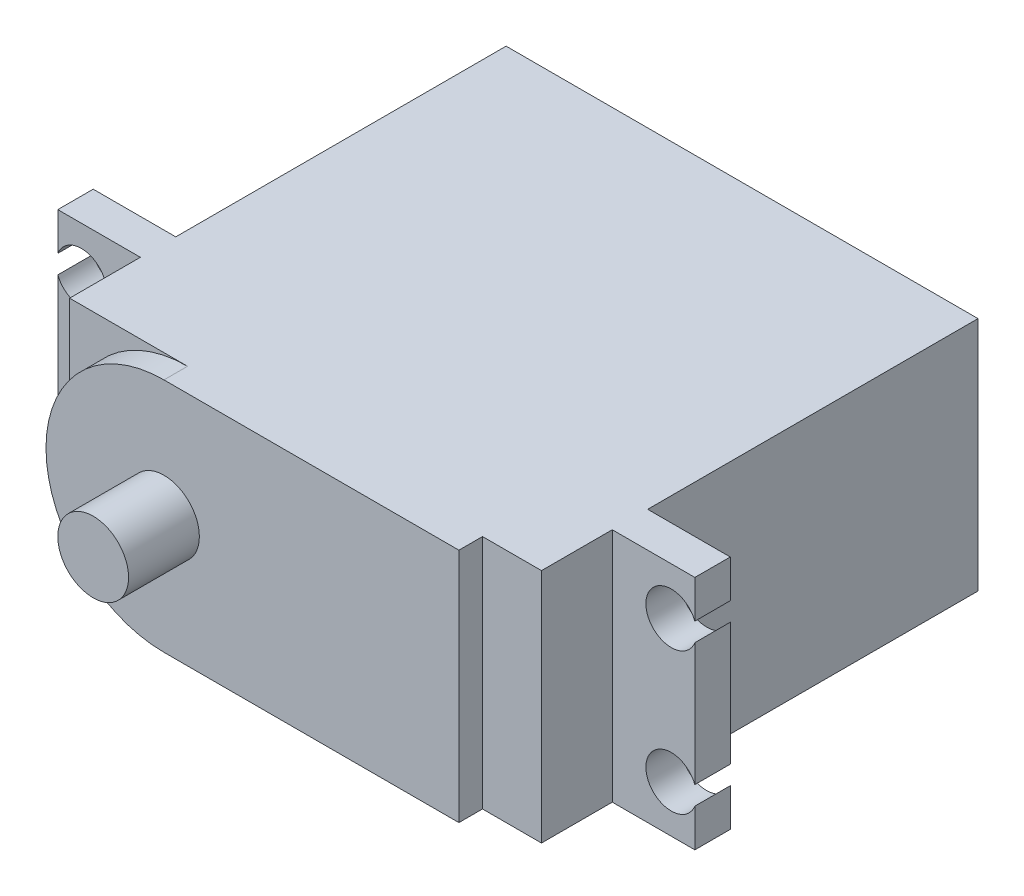
from build123d import *

# Parameters (mm, degrees)
SKETCH1_W           = 40
SKETCH1_H           = 20
BOSS_EXTRUDE1_DEPTH = 37
BOSS_EXTRUDE2_DEPTH = 2
SKETCH3_W           = 3
SKETCH3_H           = 20
BOSS_EXTRUDE3_DEPTH = 7
SKETCH4_W           = 3
SKETCH4_H           = 20
BOSS_EXTRUDE4_DEPTH = 7
SKETCH8_R           = 2.15
CUT_EXTRUDE9_DEPTH  = 7
CUT_EXTRUDE10_REACH = 44.308
SKETCH9_R           = 2.15
CUT_EXTRUDE11_REACH = 44.308
SKETCH10_R          = 2.15
SKETCH11_R          = 3
BOSS_EXTRUDE5_DEPTH = 6


with BuildPart() as part:
    # Sketch1 → Boss-Extrude1 (new body)
    with BuildSketch(Plane.XY):
        Rectangle(SKETCH1_W, SKETCH1_H)
    extrude(amount=BOSS_EXTRUDE1_DEPTH)

    # Sketch2 → Boss-Extrude2 (add)
    with BuildSketch(Plane.XY.offset(37)):
        with BuildLine():
            Line((15, 10), (15, -10))
            Line((15, -10), (-10, -10))
            ThreePointArc((-10, -10), (-20, 0), (-10, 10))
            Line((-10, 10), (15, 10))
        make_face()
    extrude(amount=BOSS_EXTRUDE2_DEPTH)

    # Sketch3 → Boss-Extrude3 (add)
    with BuildSketch(Plane(origin=(20, 0, 0), x_dir=(0, 0, -1), z_dir=(1, 0, 0))):
        with Locations((-29.5, 0)):
            Rectangle(SKETCH3_W, SKETCH3_H)
    extrude(amount=BOSS_EXTRUDE3_DEPTH)

    # Sketch4 → Boss-Extrude4 (add)
    with BuildSketch(Plane.ZY.offset(20)):
        with Locations((29.5, 0)):
            Rectangle(SKETCH4_W, SKETCH4_H)
    extrude(amount=BOSS_EXTRUDE4_DEPTH)

    # Sketch8 → Cut-Extrude9 (cut)
    with BuildSketch(Plane.XY.offset(31)):
        with Locations((-25, 6)):
            Circle(SKETCH8_R)
    extrude(amount=-CUT_EXTRUDE9_DEPTH, mode=Mode.SUBTRACT)

    # Sketch9 → Cut-Extrude10 (cut, up to next)
    with BuildSketch(Plane.XY.offset(31), mode=Mode.PRIVATE) as cut_extrude10_sk1:
        with Locations((-25, -6)):
            Circle(SKETCH9_R)
    cut_extrude10_tool1 = extrude(cut_extrude10_sk1.sketch, amount=-CUT_EXTRUDE10_REACH, mode=Mode.PRIVATE) & part.part
    add(cut_extrude10_tool1.solids().sort_by_distance((-25, -6, 31))[0], mode=Mode.SUBTRACT)

    # Sketch10 → Cut-Extrude11 (cut, up to next)
    with BuildSketch(Plane.XY.offset(31), mode=Mode.PRIVATE) as cut_extrude11_sk1:
        with Locations((25, 6)):
            Circle(SKETCH10_R)
    cut_extrude11_tool1 = extrude(cut_extrude11_sk1.sketch, amount=-CUT_EXTRUDE11_REACH, mode=Mode.PRIVATE) & part.part
    # Sketch10 → Cut-Extrude11 (cut, up to next)
    with BuildSketch(Plane.XY.offset(31), mode=Mode.PRIVATE) as cut_extrude11_sk2:
        with Locations((25, -6)):
            Circle(SKETCH10_R)
    cut_extrude11_tool2 = extrude(cut_extrude11_sk2.sketch, amount=-CUT_EXTRUDE11_REACH, mode=Mode.PRIVATE) & part.part
    add(cut_extrude11_tool1.solids().sort_by_distance((25, 6, 31))[0], mode=Mode.SUBTRACT)
    add(cut_extrude11_tool2.solids().sort_by_distance((25, -6, 31))[0], mode=Mode.SUBTRACT)

    # Sketch11 → Boss-Extrude5 (add)
    with BuildSketch(Plane.XY.offset(39)):
        with Locations((-10, 0)):
            Circle(SKETCH11_R)
    extrude(amount=BOSS_EXTRUDE5_DEPTH)


solid = part.part
